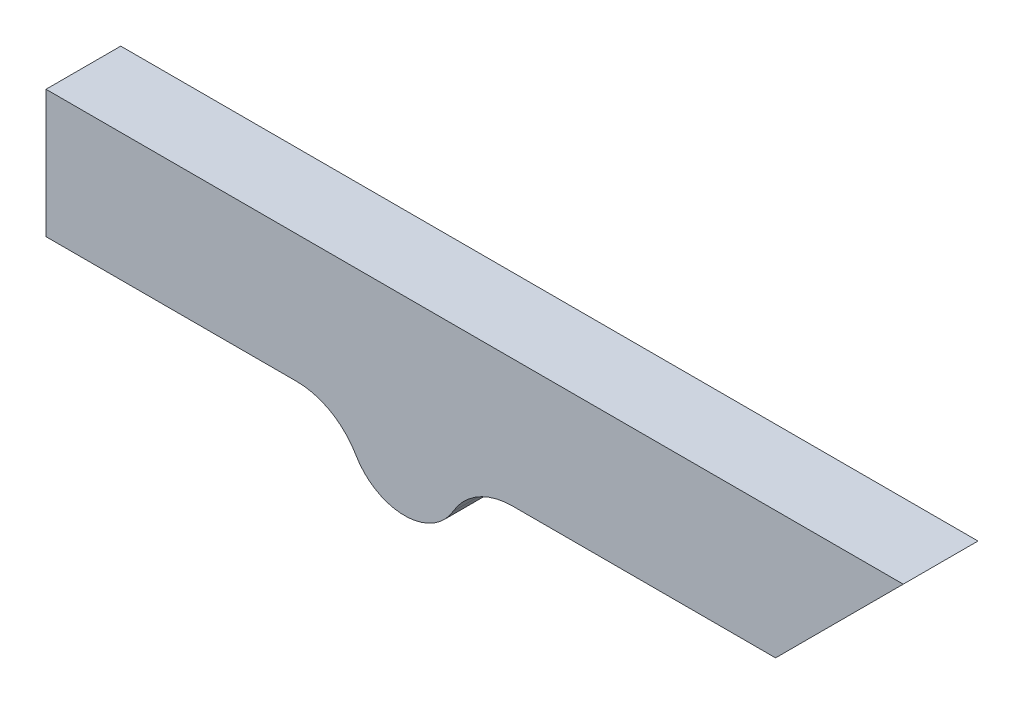
from build123d import *

# Parameters (mm, degrees)
BOSS_EXTRUDE1_DEPTH = 1.2


with BuildPart() as part:
    # Sketch1 → Boss-Extrude1 (new body)
    with BuildSketch(Plane.XY):
        with BuildLine():
            Line((23.337922061, 10.61), (25.387922061, 12.66))
            Line((25.387922061, 12.66), (11.625, 12.66))
            Line((11.625, 12.66), (11.625, 10.61))
            Line((11.625, 10.61), (15.649410223, 10.61))
            ThreePointArc((15.649410223, 10.61), (16.199410223, 10.462627944), (16.602038167, 10.06))
            ThreePointArc((16.602038167, 10.06), (17.381461031, 9.61), (18.160883894, 10.06))
            ThreePointArc((18.160883894, 10.06), (18.563511838, 10.462627944), (19.113511838, 10.61))
            Line((19.113511838, 10.61), (23.337922061, 10.61))
        make_face()
    extrude(amount=BOSS_EXTRUDE1_DEPTH)


solid = part.part
